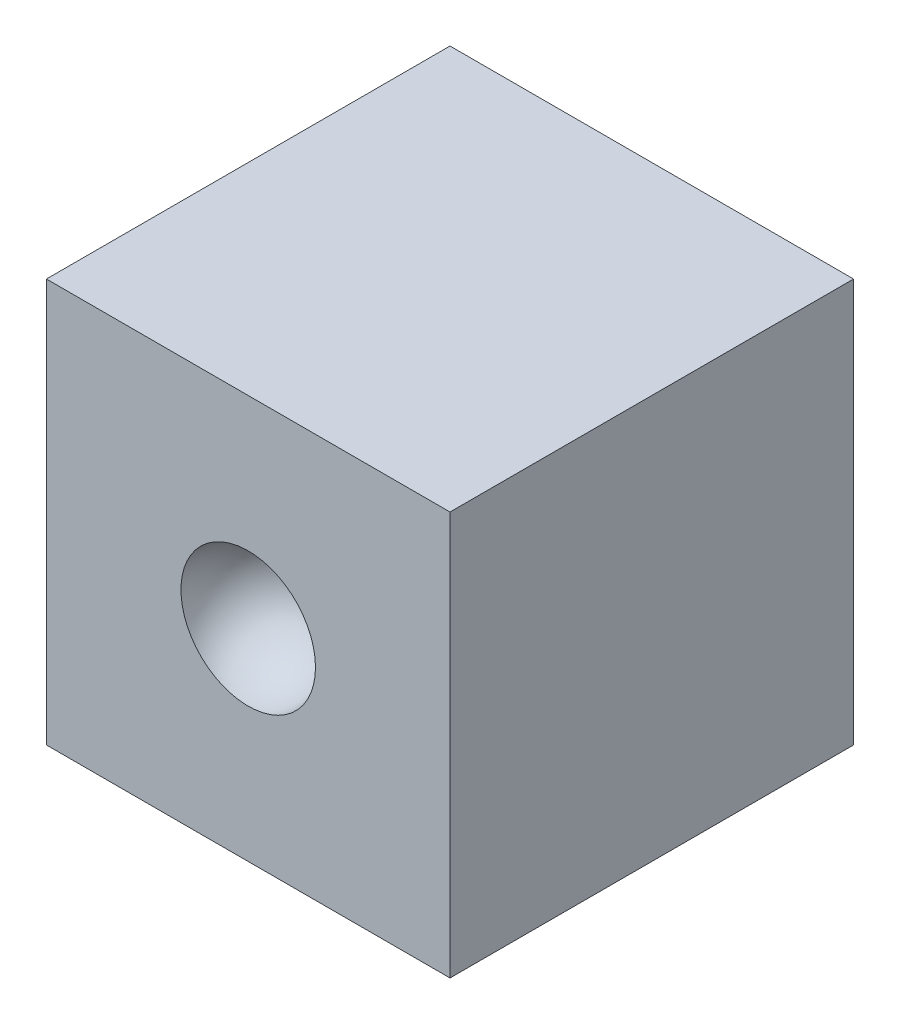
from build123d import *
from build123d.topology import SkipClean

# Parameters (mm, degrees)
SKETCH1_W           = 18
SKETCH1_H           = 18
BOSS_EXTRUDE1_DEPTH = 18


with BuildPart() as part:
    # Sketch1 → Boss-Extrude1 (new body)
    with BuildSketch(Plane.XY):
        Rectangle(SKETCH1_W, SKETCH1_H)
    extrude(amount=BOSS_EXTRUDE1_DEPTH)

    # Sketch2 → Cut-Revolve1 (revolve, cut)
    with SkipClean():  # the faces are left unmerged after this step: merging them gives an invalid solid
        with BuildSketch(Plane.XY.offset(18)):
            with BuildLine():
                ThreePointArc((3, 0), (2.121320344, 2.121320344), (0, 3))
                Line((0, 3), (0, -3))
                ThreePointArc((0, -3), (2.121320344, -2.121320344), (3, 0))
            make_face()
            with BuildLine():
                Line((0, -3), (0, 3))
                ThreePointArc((0, 3), (-3, 0), (0, -3))
            make_face()
        revolve(axis=Axis((0, 3, 18), (0, -1, 0)), mode=Mode.SUBTRACT)


solid = part.part
